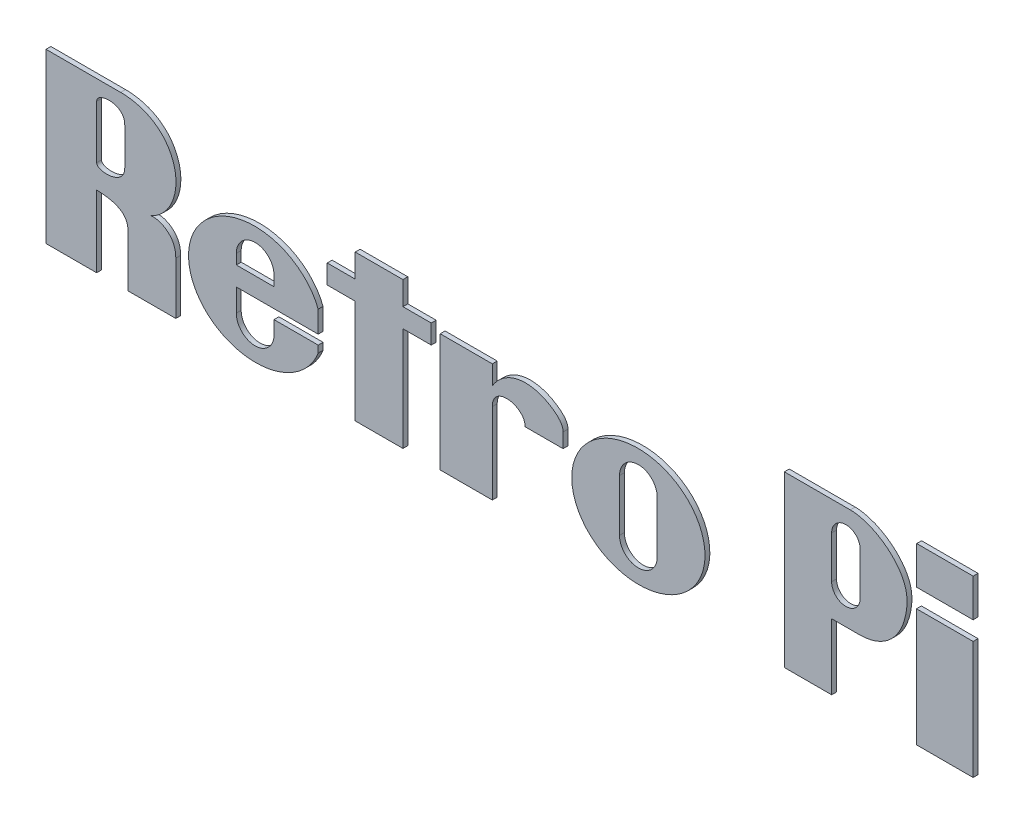
from build123d import *

# Parameters (mm, degrees)
SKETCH1_RX            = 1.735148958
SKETCH1_RY            = 1.533180203
BOSS_EXTRUDE1_DEPTH   = 0.127
BOSS_EXTRUDE1_2_DEPTH = 0.127
BOSS_EXTRUDE1_3_DEPTH = 0.127
BOSS_EXTRUDE1_4_DEPTH = 0.127
BOSS_EXTRUDE1_5_DEPTH = 0.127
SKETCH1_W             = 1.469882779
SKETCH1_H             = 0.986305708
BOSS_EXTRUDE1_6_DEPTH = 0.127
SKETCH1_W_2           = 1.474670671
SKETCH1_H_2           = 3.070246412
BOSS_EXTRUDE1_7_DEPTH = 0.127
BOSS_EXTRUDE1_8_DEPTH = 0.127


with BuildPart() as part:
    # Sketch1 → Boss-Extrude1 (new body)
    with BuildSketch(Plane.XY):
        with Locations(Location((-16.152147606, -3.134092867), (0, 0, 178.374756608))):
            Ellipse(SKETCH1_RX, SKETCH1_RY)
        with BuildLine():
            Line((-15.660776991, -2.455740515), (-15.660776991, -3.805039669))
            ThreePointArc((-15.660776991, -3.805039669), (-16.152147606, -4.296410283), (-16.64351822, -3.805039669))
            Line((-16.64351822, -3.805039669), (-16.64351822, -2.455740515))
            ThreePointArc((-16.64351822, -2.455740515), (-16.152147606, -1.9643699), (-15.660776991, -2.455740515))
        make_face(mode=Mode.SUBTRACT)
    extrude(amount=BOSS_EXTRUDE1_DEPTH)


with BuildPart() as body_2:
    # Sketch1 → Boss-Extrude1 2 (new body)
    with BuildSketch(Plane.XY):
        with BuildLine():
            Line((-30.263267279, -2.822856992), (-30.263267279, -4.692781704))
            Line((-30.263267279, -4.692781704), (-31.582122128, -4.692781704))
            Line((-31.582122128, -4.692781704), (-31.582122128, -0.310735913))
            Line((-31.582122128, -0.310735913), (-29.636644902, -0.310735913))
            add(Edge.make_bspline(
                [(-29.636644902, -0.310735913), (-29.136739082, -0.310735913), (-28.472069294, -0.610746925), (-28.042557497, -1.741092947), (-28.404859995, -2.503287935), (-28.854379149, -2.697710409)],
                knots=[0, 0, 0, 0, 0.382534351, 0.585860558, 1, 1, 1, 1], degree=3))
            add(Edge.make_bspline(
                [(-28.854379149, -2.697710409), (-28.640120437, -2.670744605), (-28.284715318, -2.86319074), (-28.201147143, -3.18867445), (-28.201147143, -3.332836459)],
                knots=[0, 0, 0, 0, 0.617780194, 1, 1, 1, 1], degree=3))
            Line((-28.201147143, -3.332836459), (-28.201147143, -4.692781704))
            Line((-28.201147143, -4.692781704), (-29.447763618, -4.692781704))
            Line((-29.447763618, -4.692781704), (-29.447763618, -3.332836459))
            add(Edge.make_bspline(
                [(-30.263267279, -2.822856992), (-29.648018977, -2.844256705), (-29.447763618, -3.039979499), (-29.447763618, -3.332836459)],
                knots=[0, 0, 0, 0, 1, 1, 1, 1], degree=3))
        make_face()
        with BuildLine():
            Line((-30.263267279, -2.209609755), (-30.263267279, -0.826360576))
            add(Edge.make_bspline(
                [(-30.263267279, -0.826360576), (-30.263267279, -0.580516398), (-29.530822817, -0.52375832), (-29.530822817, -0.987984864)],
                knots=[0, 0, 0, 0, 1, 1, 1, 1], degree=3))
            Line((-29.530822817, -0.987984864), (-29.530822817, -1.966364271))
            add(Edge.make_bspline(
                [(-30.263267279, -2.209609755), (-30.263267279, -2.402906352), (-29.530822817, -2.412391041), (-29.530822817, -1.966364271)],
                knots=[0, 0, 0, 0, 1, 1, 1, 1], degree=3))
        make_face(mode=Mode.SUBTRACT)
    extrude(amount=BOSS_EXTRUDE1_2_DEPTH)


with BuildPart() as body_3:
    # Sketch1 → Boss-Extrude1 3 (new body)
    with BuildSketch(Plane.XY):
        Polygon((-23.527701666, -1.966364271), (-23.527701666, -4.666656297), (-22.284311384, -4.666656297), (-22.284311384, -1.966364271), (-21.547487513, -1.966364271), (-21.547487513, -1.468170858), (-22.284311384, -1.468170858), (-22.284311384, -0.856941966), (-23.527701666, -0.856941966), (-23.527701666, -1.468170858), (-24.256152538, -1.468170858), (-24.256152538, -1.966364271), align=None)
    extrude(amount=BOSS_EXTRUDE1_3_DEPTH)


with BuildPart() as body_4:
    # Sketch1 → Boss-Extrude1 4 (new body)
    with BuildSketch(Plane.XY):
        with BuildLine():
            Line((-21.313043555, -1.593765836), (-19.956617793, -1.593765836))
            Line((-19.956617793, -1.593765836), (-19.956617793, -2.089398335))
            add(Edge.make_bspline(
                [(-19.956617793, -2.089398335), (-19.579903191, -1.483585225), (-18.697968223, -1.459217489), (-18.113054457, -2.055386984), (-18.113054457, -2.209609755)],
                knots=[0, 0, 0, 0, 0.802411557, 1, 1, 1, 1], degree=3))
            Line((-18.113054457, -2.209609755), (-18.113054457, -2.586287503))
            Line((-18.113054457, -2.586287503), (-19.10183212, -2.586287503))
            add(Edge.make_bspline(
                [(-19.956617793, -2.559515195), (-19.956617793, -1.992315617), (-19.099507004, -2.135775384), (-19.10183212, -2.586287503)],
                knots=[0, 0, 0, 0, 1, 1, 1, 1], degree=3))
            Line((-19.956617793, -2.559515195), (-19.956617793, -4.666656297))
            Line((-19.956617793, -4.666656297), (-21.313043555, -4.666656297))
            Line((-21.313043555, -4.666656297), (-21.313043555, -1.593765836))
        make_face()
    extrude(amount=BOSS_EXTRUDE1_4_DEPTH)


with BuildPart() as body_5:
    # Sketch1 → Boss-Extrude1 5 (new body)
    with BuildSketch(Plane.XY):
        with BuildLine():
            Line((-12.349477508, -0.225919474), (-10.632213364, -0.225919474))
            add(Edge.make_bspline(
                [(-10.632213364, -0.225919474), (-10.034137162, -0.225919474), (-9.083331902, -0.880571914), (-9.225226195, -2.511762322), (-9.832263332, -2.923751991), (-10.391318264, -2.923751991)],
                knots=[0, 0, 0, 0, 0.403060772, 0.503060772, 1, 1, 1, 1], degree=3))
            Line((-10.391318264, -2.923751991), (-11.117211162, -2.923751991))
            Line((-11.117211162, -2.923751991), (-11.117211162, -4.640730661))
            Line((-11.117211162, -4.640730661), (-12.349477508, -4.640730661))
            Line((-12.349477508, -4.640730661), (-12.349477508, -0.225919474))
        make_face()
        with BuildLine():
            Line((-10.373486814, -0.987984864), (-10.373486814, -2.089398335))
            ThreePointArc((-10.373486814, -2.089398335), (-10.745761872, -2.461673393), (-11.118036931, -2.089398335))
            Line((-11.118036931, -2.089398335), (-11.118036931, -0.987984864))
            ThreePointArc((-11.118036931, -0.987984864), (-10.745761872, -0.615709806), (-10.373486814, -0.987984864))
        make_face(mode=Mode.SUBTRACT)
    extrude(amount=BOSS_EXTRUDE1_5_DEPTH)


with BuildPart() as body_6:
    # Sketch1 → Boss-Extrude1 6 (new body)
    with BuildSketch(Plane.XY):
        with Locations((-8.16725403, -0.613455794)):
            Rectangle(SKETCH1_W, SKETCH1_H)
    extrude(amount=BOSS_EXTRUDE1_6_DEPTH)


with BuildPart() as body_7:
    # Sketch1 → Boss-Extrude1 7 (new body)
    with BuildSketch(Plane.XY):
        with Locations((-8.169647976, -3.128889042)):
            Rectangle(SKETCH1_W_2, SKETCH1_H_2)
    extrude(amount=BOSS_EXTRUDE1_7_DEPTH)


with BuildPart() as body_8:
    # Sketch1 → Boss-Extrude1 8 (new body)
    with BuildSketch(Plane.XY):
        with BuildLine():
            Line((-24.491912245, -2.629363052), (-24.491912245, -3.193395132))
            Line((-24.491912245, -3.193395132), (-26.625366229, -3.193395132))
            Line((-26.625366229, -3.193395132), (-26.625366229, -3.785141847))
            ThreePointArc((-26.625366229, -3.785141847), (-26.133995615, -4.276512462), (-25.642625, -3.785141847))
            Line((-25.642625, -3.785141847), (-25.642625, -3.438942656))
            Line((-25.642625, -3.438942656), (-24.491912245, -3.438942656))
            Line((-24.491912245, -3.438942656), (-24.491912245, -3.619444468))
            add(Edge.make_bspline(
                [(-24.491912245, -2.629363052), (-25.255067925, -0.64749638), (-27.160613393, -1.871731189), (-29.066158861, -3.095965998), (-27.160613393, -4.343894085), (-25.255067925, -5.591822172), (-24.491912245, -3.619444468)],
                knots=[0.353811549, 0.353811549, 0.353811549, 2.229042672, 2.229042672, 4.104273795, 4.104273795, 5.979504918, 5.979504918, 5.979504918], degree=2, weights=[1, 0.591711919, 1, 0.591711919, 1, 0.591711919, 1]))
        make_face()
        with BuildLine():
            Line((-25.642625, -2.435842693), (-25.642625, -2.697710409))
            Line((-25.642625, -2.697710409), (-26.625366229, -2.697710409))
            Line((-26.625366229, -2.697710409), (-26.625366229, -2.435842693))
            ThreePointArc((-26.625366229, -2.435842693), (-26.133995615, -1.944472079), (-25.642625, -2.435842693))
        make_face(mode=Mode.SUBTRACT)
    extrude(amount=BOSS_EXTRUDE1_8_DEPTH)


solid = Compound([part.part, body_2.part, body_3.part, body_4.part, body_5.part, body_6.part, body_7.part, body_8.part])
